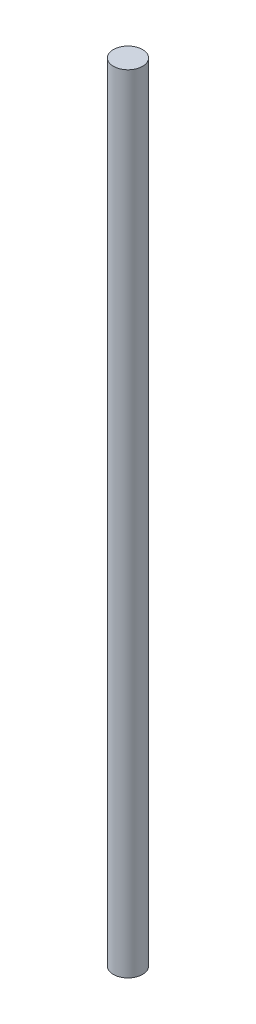
from build123d import *

# Parameters (mm, degrees)
SKETCH1_R           = 5
BOSS_EXTRUDE1_DEPTH = 270


with BuildPart() as part:
    # Sketch1 → Boss-Extrude1 (new body)
    with BuildSketch(Plane(origin=(0, 0, 0), x_dir=(1, 0, 0), z_dir=(0, 1, 0))):
        with Locations(Location((1.328390805, 0, 0), (0, 0, 270))):
            Circle(SKETCH1_R)
    extrude(amount=BOSS_EXTRUDE1_DEPTH)


solid = part.part
